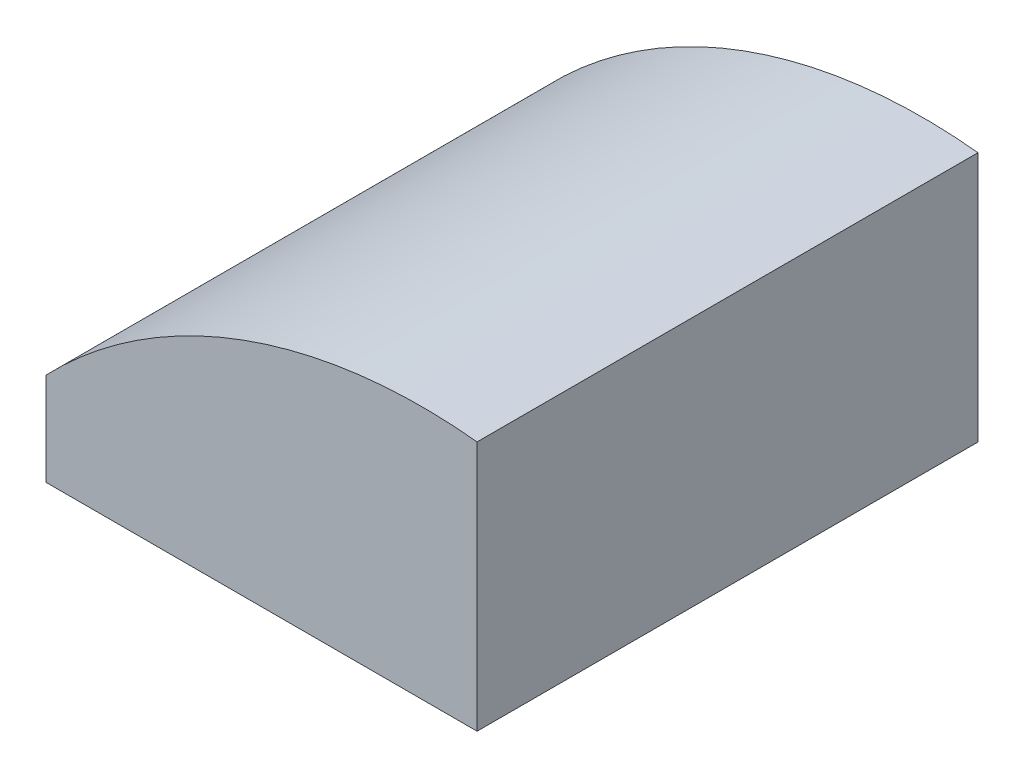
from build123d import *

# Parameters (mm, degrees)
EXTRUDE1_DEPTH = 50.8


with BuildPart() as part:
    # Sketch1 → Extrude1 (new body)
    with BuildSketch(Plane.XY):
        with BuildLine():
            Line((0, 0), (0, 9.420165094))
            ThreePointArc((0, 9.420165094), (20.001454101, 22.494772168), (43.718188319, 25.413681947))
            Line((43.718188319, 25.413681947), (43.718188319, 0))
            Line((43.718188319, 0), (0, 0))
        make_face()
    extrude(amount=-EXTRUDE1_DEPTH)


solid = part.part
